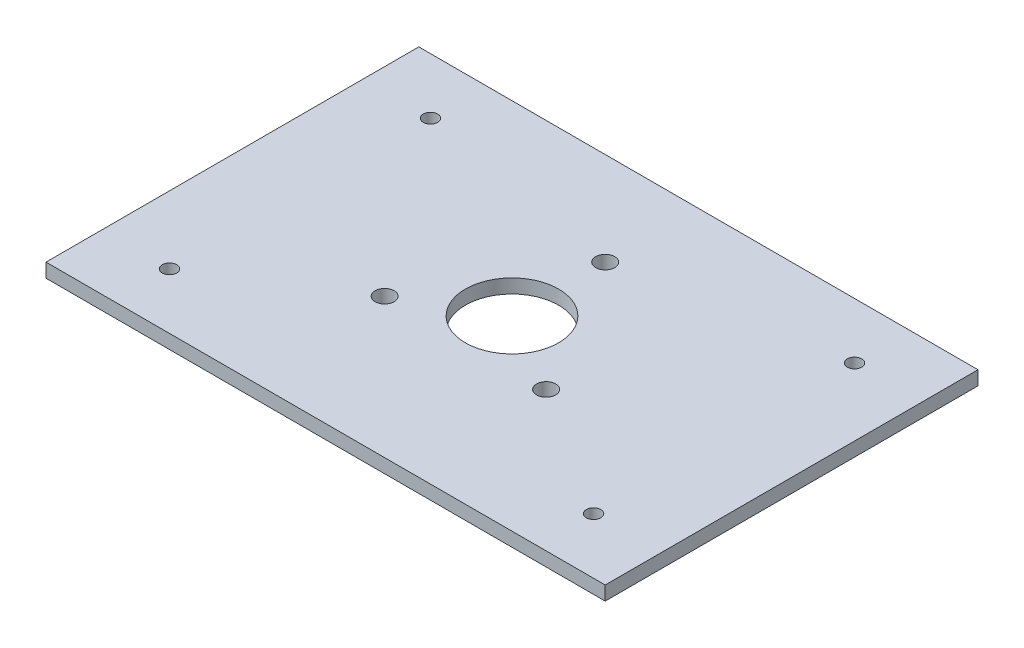
from build123d import *

# Parameters (mm, degrees)
SKETCH_1_W      = 120
SKETCH_1_H      = 80
SKETCH_1_R      = 2.05
SKETCH_1_R_2    = 10
SKETCH_1_R_3    = 1.55
EXTRUDE_1_DEPTH = 3


with BuildPart() as part:
    # 草图1 → 凸台-拉伸1 (new body)
    with BuildSketch(Plane(origin=(0, 0, 0), x_dir=(1, 0, 0), z_dir=(0, 1, 0))):
        with Locations((60, 40)):
            Rectangle(SKETCH_1_W, SKETCH_1_H)
        with Locations(Location((60, 60, 0), (0, 0, 270))):
            Circle(SKETCH_1_R, mode=Mode.SUBTRACT)
        with Locations(Location((60, 40, 0), (0, 0, 270))):
            Circle(SKETCH_1_R_2, mode=Mode.SUBTRACT)
        with Locations(Location((77.320508076, 30, 0), (0, 0, 270))):
            Circle(SKETCH_1_R, mode=Mode.SUBTRACT)
        with Locations(Location((42.679491924, 30, 0), (0, 0, 270))):
            Circle(SKETCH_1_R, mode=Mode.SUBTRACT)
        with Locations(Location((14.5, 68, 0), (0, 0, 270))):
            Circle(SKETCH_1_R_3, mode=Mode.SUBTRACT)
        with Locations(Location((14.5, 12, 0), (0, 0, 90))):
            Circle(SKETCH_1_R_3, mode=Mode.SUBTRACT)
        with Locations(Location((105.5, 12, 0), (0, 0, 270))):
            Circle(SKETCH_1_R_3, mode=Mode.SUBTRACT)
        with Locations(Location((105.5, 68, 0), (0, 0, 90))):
            Circle(SKETCH_1_R_3, mode=Mode.SUBTRACT)
    extrude(amount=EXTRUDE_1_DEPTH)


solid = part.part
